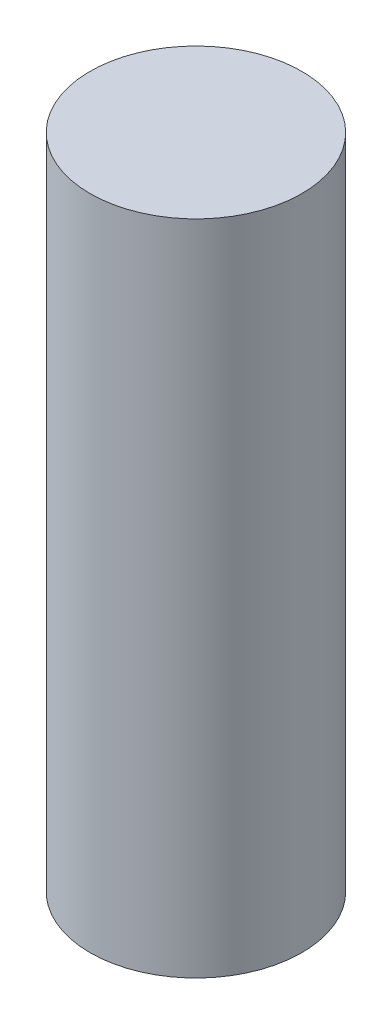
from build123d import *

# Parameters (mm, degrees)
SKETCH1_R           = 12
BOSS_EXTRUDE1_DEPTH = 74.5


with BuildPart() as part:
    # Sketch1 → Boss-Extrude1 (new body)
    with BuildSketch(Plane(origin=(0, 0, 0), x_dir=(1, 0, 0), z_dir=(0, 1, 0))):
        with Locations(Location((0, 0, 0), (0, 0, 270))):
            Circle(SKETCH1_R)
    extrude(amount=BOSS_EXTRUDE1_DEPTH)


solid = part.part
